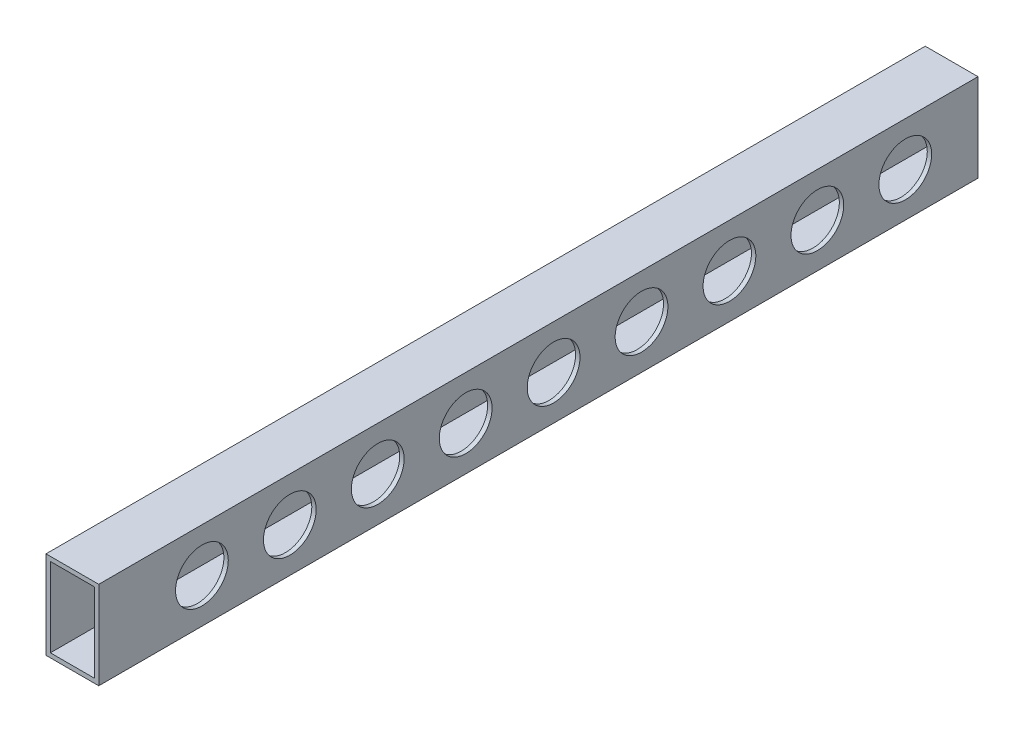
from build123d import *

# Parameters (mm, degrees)
SKETCH1_W           = 38.1
SKETCH1_H           = 63.5
SKETCH1_W_2         = 31.75
SKETCH1_H_2         = 57.15
BOSS_EXTRUDE1_DEPTH = 635
CUT_EXTRUDE1_REACH  = 638.934
SKETCH2_R           = 19.05


with BuildPart() as part:
    # Sketch1 → Boss-Extrude1 (new body)
    with BuildSketch(Plane.XY):
        Rectangle(SKETCH1_W, SKETCH1_H)
        Rectangle(SKETCH1_W_2, SKETCH1_H_2, mode=Mode.SUBTRACT)
    extrude(amount=BOSS_EXTRUDE1_DEPTH)

    # Cut-Extrude1: up to this face of the body (flat: up to its plane)
    cut_extrude1_end = Plane(part.part.faces().sort_by_distance((-19.05, 0, 317.5))[0])
    # Sketch2 → Cut-Extrude1 (cut, up to the picked face)
    with BuildSketch(Plane(origin=(19.05, 0, 0), x_dir=(0, 0, -1), z_dir=(1, 0, 0)), mode=Mode.PRIVATE) as cut_extrude1_sk1:
        with Locations((-560.5018, 0)):
            Circle(SKETCH2_R)
    cut_extrude1_tool1 = split(extrude(cut_extrude1_sk1.sketch, amount=-CUT_EXTRUDE1_REACH, mode=Mode.PRIVATE), bisect_by=cut_extrude1_end, keep=Keep.BOTH, mode=Mode.PRIVATE)
    # Sketch2 → Cut-Extrude1 (cut, up to the picked face)
    with BuildSketch(Plane(origin=(19.05, 0, 0), x_dir=(0, 0, -1), z_dir=(1, 0, 0)), mode=Mode.PRIVATE) as cut_extrude1_sk2:
        with Locations((-497.0018, 0)):
            Circle(SKETCH2_R)
    cut_extrude1_tool2 = split(extrude(cut_extrude1_sk2.sketch, amount=-CUT_EXTRUDE1_REACH, mode=Mode.PRIVATE), bisect_by=cut_extrude1_end, keep=Keep.BOTH, mode=Mode.PRIVATE)
    # Sketch2 → Cut-Extrude1 (cut, up to the picked face)
    with BuildSketch(Plane(origin=(19.05, 0, 0), x_dir=(0, 0, -1), z_dir=(1, 0, 0)), mode=Mode.PRIVATE) as cut_extrude1_sk3:
        with Locations((-433.5018, 0)):
            Circle(SKETCH2_R)
    cut_extrude1_tool3 = split(extrude(cut_extrude1_sk3.sketch, amount=-CUT_EXTRUDE1_REACH, mode=Mode.PRIVATE), bisect_by=cut_extrude1_end, keep=Keep.BOTH, mode=Mode.PRIVATE)
    # Sketch2 → Cut-Extrude1 (cut, up to the picked face)
    with BuildSketch(Plane(origin=(19.05, 0, 0), x_dir=(0, 0, -1), z_dir=(1, 0, 0)), mode=Mode.PRIVATE) as cut_extrude1_sk4:
        with Locations((-370.0018, 0)):
            Circle(SKETCH2_R)
    cut_extrude1_tool4 = split(extrude(cut_extrude1_sk4.sketch, amount=-CUT_EXTRUDE1_REACH, mode=Mode.PRIVATE), bisect_by=cut_extrude1_end, keep=Keep.BOTH, mode=Mode.PRIVATE)
    # Sketch2 → Cut-Extrude1 (cut, up to the picked face)
    with BuildSketch(Plane(origin=(19.05, 0, 0), x_dir=(0, 0, -1), z_dir=(1, 0, 0)), mode=Mode.PRIVATE) as cut_extrude1_sk5:
        with Locations((-306.5018, 0)):
            Circle(SKETCH2_R)
    cut_extrude1_tool5 = split(extrude(cut_extrude1_sk5.sketch, amount=-CUT_EXTRUDE1_REACH, mode=Mode.PRIVATE), bisect_by=cut_extrude1_end, keep=Keep.BOTH, mode=Mode.PRIVATE)
    # Sketch2 → Cut-Extrude1 (cut, up to the picked face)
    with BuildSketch(Plane(origin=(19.05, 0, 0), x_dir=(0, 0, -1), z_dir=(1, 0, 0)), mode=Mode.PRIVATE) as cut_extrude1_sk6:
        with Locations((-243.0018, 0)):
            Circle(SKETCH2_R)
    cut_extrude1_tool6 = split(extrude(cut_extrude1_sk6.sketch, amount=-CUT_EXTRUDE1_REACH, mode=Mode.PRIVATE), bisect_by=cut_extrude1_end, keep=Keep.BOTH, mode=Mode.PRIVATE)
    # Sketch2 → Cut-Extrude1 (cut, up to the picked face)
    with BuildSketch(Plane(origin=(19.05, 0, 0), x_dir=(0, 0, -1), z_dir=(1, 0, 0)), mode=Mode.PRIVATE) as cut_extrude1_sk7:
        with Locations((-179.5018, 0)):
            Circle(SKETCH2_R)
    cut_extrude1_tool7 = split(extrude(cut_extrude1_sk7.sketch, amount=-CUT_EXTRUDE1_REACH, mode=Mode.PRIVATE), bisect_by=cut_extrude1_end, keep=Keep.BOTH, mode=Mode.PRIVATE)
    # Sketch2 → Cut-Extrude1 (cut, up to the picked face)
    with BuildSketch(Plane(origin=(19.05, 0, 0), x_dir=(0, 0, -1), z_dir=(1, 0, 0)), mode=Mode.PRIVATE) as cut_extrude1_sk8:
        with Locations((-116.0018, 0)):
            Circle(SKETCH2_R)
    cut_extrude1_tool8 = split(extrude(cut_extrude1_sk8.sketch, amount=-CUT_EXTRUDE1_REACH, mode=Mode.PRIVATE), bisect_by=cut_extrude1_end, keep=Keep.BOTH, mode=Mode.PRIVATE)
    # Sketch2 → Cut-Extrude1 (cut, up to the picked face)
    with BuildSketch(Plane(origin=(19.05, 0, 0), x_dir=(0, 0, -1), z_dir=(1, 0, 0)), mode=Mode.PRIVATE) as cut_extrude1_sk9:
        with Locations((-52.5018, 0)):
            Circle(SKETCH2_R)
    cut_extrude1_tool9 = split(extrude(cut_extrude1_sk9.sketch, amount=-CUT_EXTRUDE1_REACH, mode=Mode.PRIVATE), bisect_by=cut_extrude1_end, keep=Keep.BOTH, mode=Mode.PRIVATE)
    add(cut_extrude1_tool1.solids().sort_by(Axis((19.05, 0, 560.5018), (-1, 0, 0)))[0], mode=Mode.SUBTRACT)
    add(cut_extrude1_tool2.solids().sort_by(Axis((19.05, 0, 497.0018), (-1, 0, 0)))[0], mode=Mode.SUBTRACT)
    add(cut_extrude1_tool3.solids().sort_by(Axis((19.05, 0, 433.5018), (-1, 0, 0)))[0], mode=Mode.SUBTRACT)
    add(cut_extrude1_tool4.solids().sort_by(Axis((19.05, 0, 370.0018), (-1, 0, 0)))[0], mode=Mode.SUBTRACT)
    add(cut_extrude1_tool5.solids().sort_by(Axis((19.05, 0, 306.5018), (-1, 0, 0)))[0], mode=Mode.SUBTRACT)
    add(cut_extrude1_tool6.solids().sort_by(Axis((19.05, 0, 243.0018), (-1, 0, 0)))[0], mode=Mode.SUBTRACT)
    add(cut_extrude1_tool7.solids().sort_by(Axis((19.05, 0, 179.5018), (-1, 0, 0)))[0], mode=Mode.SUBTRACT)
    add(cut_extrude1_tool8.solids().sort_by(Axis((19.05, 0, 116.0018), (-1, 0, 0)))[0], mode=Mode.SUBTRACT)
    add(cut_extrude1_tool9.solids().sort_by(Axis((19.05, 0, 52.5018), (-1, 0, 0)))[0], mode=Mode.SUBTRACT)


solid = part.part
